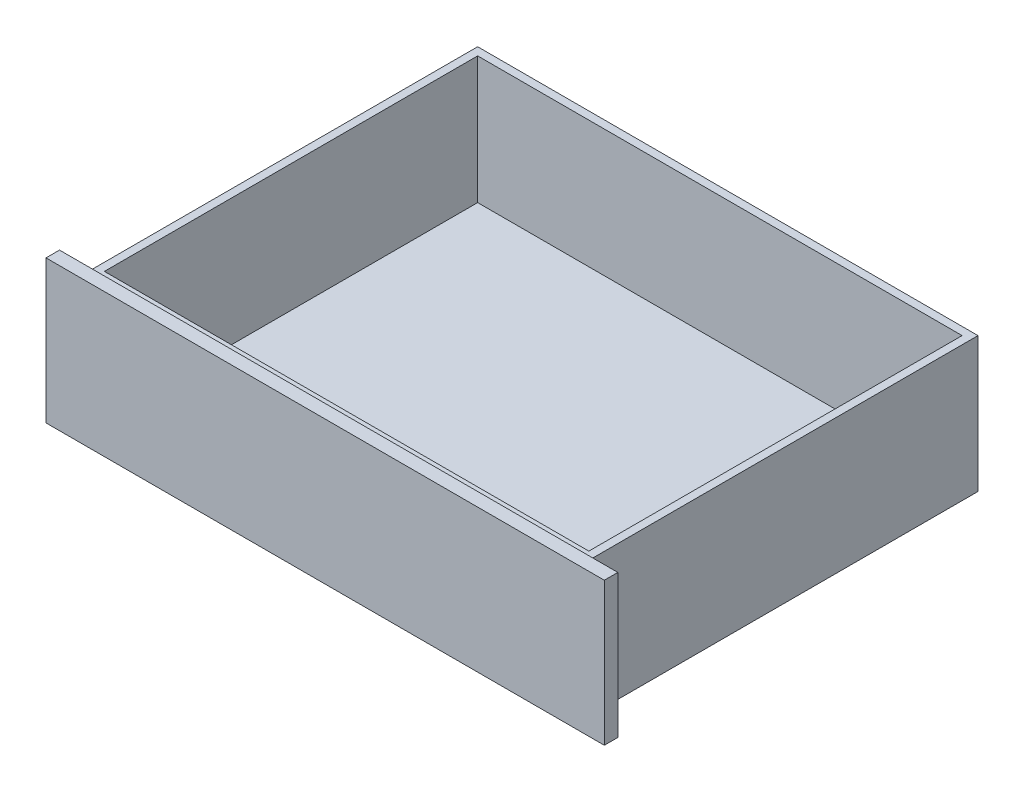
from build123d import *

# Parameters (mm, degrees)
SKETCH1_W           = 630
SKETCH1_H           = 490
EXTRUSION_DEPTH     = 170
DRAWER_S_INTERIOR_T = -10
SKETCH2_W           = 703
SKETCH2_H           = 180
BOSS_EXTRUDE2_DEPTH = 17


with BuildPart() as part:
    # Sketch1 → Extrusion (new body)
    with BuildSketch(Plane(origin=(0, 0, 0), x_dir=(1, 0, 0), z_dir=(0, 1, 0))):
        Rectangle(SKETCH1_W, SKETCH1_H)
    extrude(amount=EXTRUSION_DEPTH)

    # Drawer's interior
    drawer_s_interior_openings = [part.faces().sort_by_distance(p)[0] for p in [
        (0, 170, 0),
    ]]
    offset(amount=DRAWER_S_INTERIOR_T, openings=drawer_s_interior_openings, kind=Kind.INTERSECTION)

    # Sketch2 → Boss-Extrude2 (add)
    with BuildSketch(Plane.XY.offset(245)):
        with Locations((0, 85)):
            Rectangle(SKETCH2_W, SKETCH2_H)
    extrude(amount=BOSS_EXTRUDE2_DEPTH)


solid = part.part
